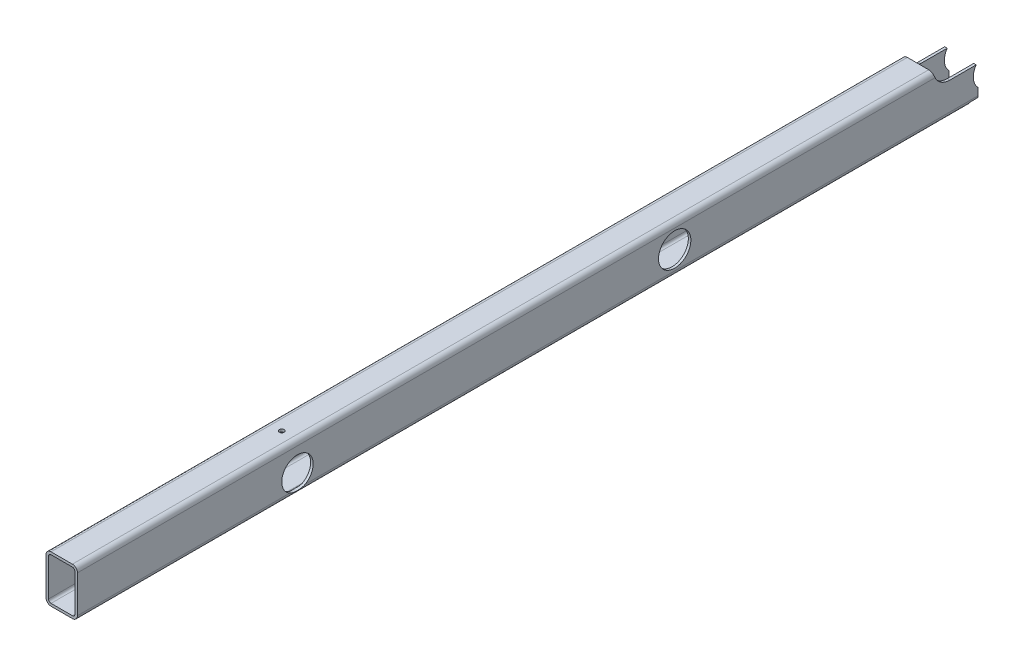
from build123d import *

# Parameters (mm, degrees)
EXTRUDE_1_DEPTH     = 2865
SKETCH_4_R          = 50
CUT_EXTRUDE_3_DEPTH = 2871.666298963
SKETCH_3_R          = 50
SKETCH_3_R_2        = 51.5
SKETCH_3_W          = 25
SKETCH_3_H          = 10
CUT_EXTRUDE_2_DEPTH = 2871.666298963
FILLET_2_R          = 5
CUT_EXTRUDE_4_REACH = 2872.666
SKETCH_5_R          = 7.5


with BuildPart() as part:
    # 草图1 → 凸台-拉伸1 (new body)
    with BuildSketch(Plane.XY):
        with BuildLine():
            Line((16, 0), (84, 0))
            ThreePointArc((84, 0), (95.313708499, -4.686291501), (100, -16))
            Line((100, -16), (100, -134))
            ThreePointArc((100, -134), (95.313708499, -145.313708499), (84, -150))
            Line((84, -150), (16, -150))
            ThreePointArc((16, -150), (4.686291501, -145.313708499), (0, -134))
            Line((0, -134), (0, -16))
            ThreePointArc((0, -16), (4.686291501, -4.686291501), (16, 0))
        make_face()
        with BuildLine():
            Line((16, -8), (84, -8))
            ThreePointArc((84, -8), (89.656854249, -10.343145751), (92, -16))
            Line((92, -16), (92, -134))
            ThreePointArc((92, -134), (89.656854249, -139.656854249), (84, -142))
            Line((84, -142), (16, -142))
            ThreePointArc((16, -142), (10.343145751, -139.656854249), (8, -134))
            Line((8, -134), (8, -16))
            ThreePointArc((8, -16), (10.343145751, -10.343145751), (16, -8))
        make_face(mode=Mode.SUBTRACT)
    extrude(amount=-EXTRUDE_1_DEPTH)

    # 草图4 → 切除-拉伸3 (cut, through all)
    with BuildSketch(Plane(origin=(100, 0, 0), x_dir=(0, 0, -1), z_dir=(1, 0, 0))):
        with Locations((2900, -75)):
            Circle(SKETCH_4_R)
    extrude(amount=-CUT_EXTRUDE_3_DEPTH, mode=Mode.SUBTRACT)

    # 草图3 → 切除-拉伸2 (cut, through all)
    with BuildSketch(Plane(origin=(100, 0, 0), x_dir=(0, 0, -1), z_dir=(1, 0, 0))):
        with Locations(Location((700, -90.5, 0), (0, 0, 240.4586395))):
            Circle(SKETCH_3_R)
        with Locations(Location((1900, -75, 0), (0, 0, 90))):
            Circle(SKETCH_3_R_2)
        with BuildLine():
            Line((2775, -46), (2865, -46))
            Line((2865, -46), (2865, 0))
            Line((2865, 0), (2724.245689838, 0))
            ThreePointArc((2724.245689838, 0), (2740.750912421, -32.788887255), (2775, -46))
        make_face()
        with Locations((2852.5, -145)):
            Rectangle(SKETCH_3_W, SKETCH_3_H)
    extrude(amount=-CUT_EXTRUDE_2_DEPTH, mode=Mode.SUBTRACT)

    # 圆角2
    fillet_2_edges = [part.edges().sort_by_distance(p)[0] for p in [
        (94.061949798, -140, -2840),
    ]]
    fillet(fillet_2_edges, radius=FILLET_2_R)

    # 草图5 → 切除-拉伸4 (cut, up to next)
    with BuildSketch(Plane(origin=(0, 0, 0), x_dir=(1, 0, 0), z_dir=(0, 1, 0)), mode=Mode.PRIVATE) as cut_extrude_4_sk1:
        with Locations(Location((50, 700, 0), (0, 0, 270))):
            Circle(SKETCH_5_R)
    cut_extrude_4_tool1 = extrude(cut_extrude_4_sk1.sketch, amount=-CUT_EXTRUDE_4_REACH, mode=Mode.PRIVATE) & part.part
    add(cut_extrude_4_tool1.solids().sort_by_distance((50, 0, -700))[0], mode=Mode.SUBTRACT)


solid = part.part
